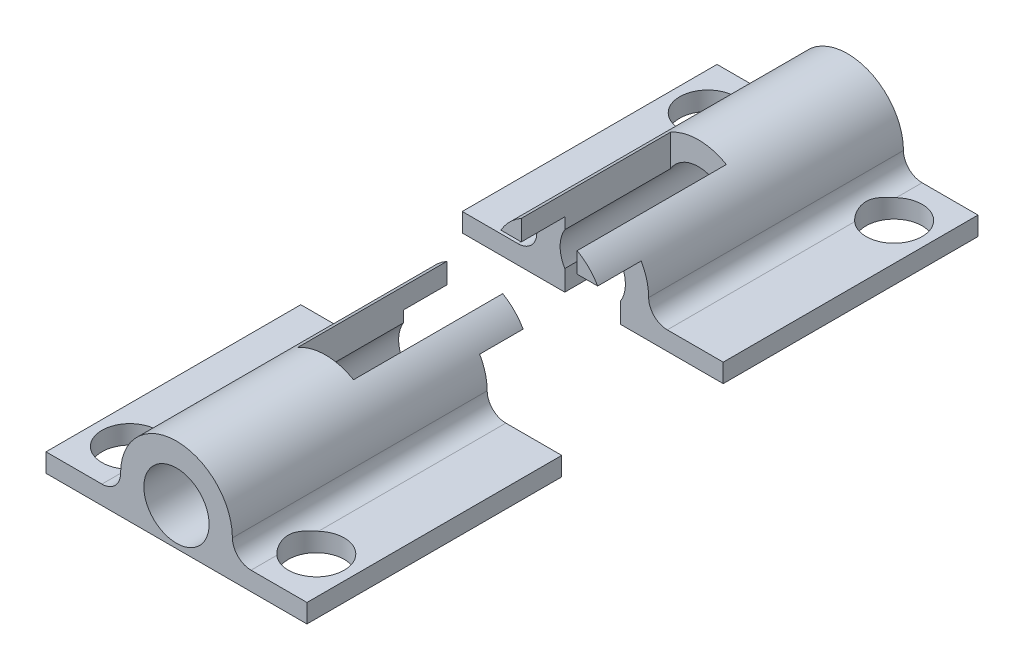
from build123d import *

# Parameters (mm, degrees)
IZIM1_R                     = 1.75
Y_KSEKLIK_EKSTR_ZYON1_DEPTH = 18
RADYUS1_R                   = 1
KES_EKSTR_ZYON3_DEPTH       = 11
KES_EKSTR_ZYON3_DEPTH_BACK  = 10
IZIM3_R                     = 1.5
KES_EKSTR_ZYON4_DEPTH       = 10
KES_EKSTR_ZYON5_DEPTH       = 13
KES_EKSTR_ZYON5_DEPTH_BACK  = 11
IZIM6_W                     = 8.662812744
IZIM6_H                     = 3.5


with BuildPart() as part:
    # Çizim1 → Yükseklik-Ekstrüzyon1 (new, symmetric)
    with BuildSketch(Plane.XY):
        with BuildLine():
            Line((-7, -2), (-7, -1))
            Line((-7, -1), (-2.828427125, -1))
            ThreePointArc((-2.828427125, -1), (0, 3), (2.828427125, -1))
            Line((2.828427125, -1), (7, -1))
            Line((7, -1), (7, -2))
            Line((7, -2), (-7, -2))
        make_face()
        Circle(IZIM1_R, mode=Mode.SUBTRACT)
    extrude(amount=Y_KSEKLIK_EKSTR_ZYON1_DEPTH, both=True)

    # Radyus1
    radyus1_edges = [part.edges().sort_by_distance(p)[0] for p in [
        (2.828427125, -1, 0),
        (-2.828427125, -1, 0),
    ]]
    fillet(radyus1_edges, radius=RADYUS1_R)

    # Çizim3 → Kes-Ekstrüzyon3 (cut, two sides: drawn at the far end of the back side and taken through both)
    with BuildSketch(Plane(origin=(0, -1, 0), x_dir=(1, 0, 0), z_dir=(0, 1, 0)).offset(-KES_EKSTR_ZYON3_DEPTH_BACK)):
        with Locations(Location((-5, -15.5, 0), (0, 0, 48.189685104))):
            Circle(IZIM3_R)
        with Locations(Location((5, -15.5, 0), (0, 0, 131.810314896))):
            Circle(IZIM3_R)
        with Locations(Location((5, 15.5, 0), (0, 0, 131.810314896))):
            Circle(IZIM3_R)
        with Locations(Location((-5, 15.5, 0), (0, 0, 48.189685104))):
            Circle(IZIM3_R)
    extrude(amount=KES_EKSTR_ZYON3_DEPTH + KES_EKSTR_ZYON3_DEPTH_BACK, mode=Mode.SUBTRACT)

    # Çizim5 → Kes-Ekstrüzyon4 (cut)
    with BuildSketch(Plane.XZ.offset(2)):
        Polygon((-1.5, -10), (0, -10), (0, 10), (-1.5, 10), (-1.5, 2), (-3.5, 2), (-3.5, 4.331406372), (-7, 4.331406372), (-7, -4.331406372), (-3.5, -4.331406372), (-3.5, -2), (-1.5, -2), align=None)
        Polygon((0, 10), (0, -10), (1.5, -10), (1.5, -2), (3.5, -2), (3.5, -4.331406372), (7, -4.331406372), (7, 4.331406372), (3.5, 4.331406372), (3.5, 2), (1.5, 2), (1.5, 10), align=None)
    extrude(amount=-KES_EKSTR_ZYON4_DEPTH, mode=Mode.SUBTRACT)


with BuildPart() as kes_ekstr_zyon4_piece_1:
    # of the separate pieces the step leaves, piece 1, a body of its own (kes_ekstr_zyon4_pieces)
    add(part.part.solids().sort_by_distance((-4, -1, -18))[0])


with BuildPart() as kes_ekstr_zyon4_piece_2:
    # of the separate pieces the step leaves, piece 2, a body of its own (kes_ekstr_zyon4_pieces)
    add(part.part.solids().sort_by_distance((-4, -1, 18))[0])


with BuildPart() as kes_ekstr_zyon5_tool:
    # Çizim6 → Kes-Ekstrüzyon5 (new, two sides: drawn at the far end of the back side and taken through both)
    with BuildSketch(Plane.ZY.offset(3.5).offset(-KES_EKSTR_ZYON5_DEPTH_BACK)):
        with Locations((0, -0.25)):
            Rectangle(IZIM6_W, IZIM6_H)
    extrude(amount=KES_EKSTR_ZYON5_DEPTH + KES_EKSTR_ZYON5_DEPTH_BACK)


with BuildPart() as kes_ekstr_zyon4_piece_1_1:
    add(kes_ekstr_zyon4_piece_1.part)

    # Kes-Ekstrüzyon5: cut by kes_ekstr_zyon5_tool
    add(kes_ekstr_zyon5_tool.part, mode=Mode.SUBTRACT)


with BuildPart() as kes_ekstr_zyon4_piece_2_1:
    add(kes_ekstr_zyon4_piece_2.part)

    # Kes-Ekstrüzyon5: cut by kes_ekstr_zyon5_tool
    add(kes_ekstr_zyon5_tool.part, mode=Mode.SUBTRACT)


solid = Compound([kes_ekstr_zyon4_piece_1_1.part, kes_ekstr_zyon4_piece_2_1.part])
